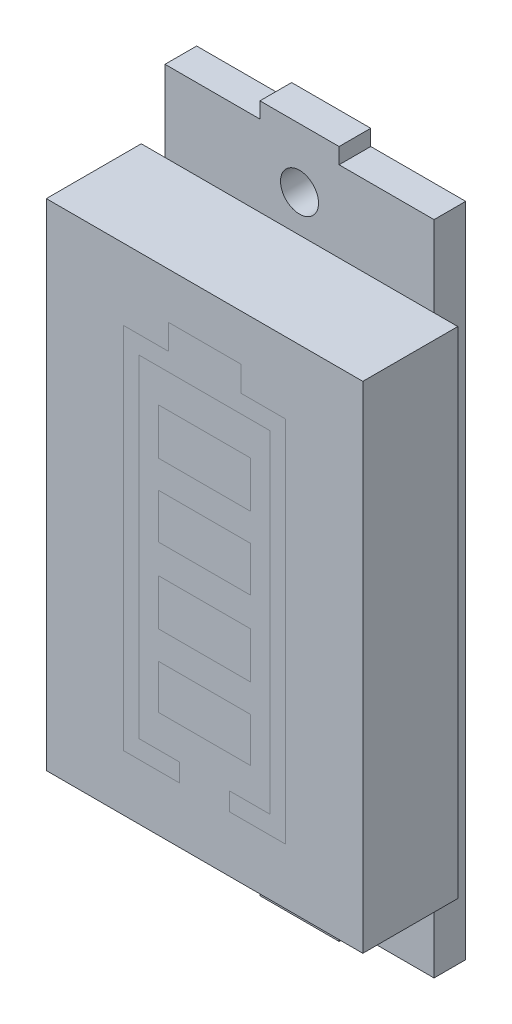
from build123d import *

# Parameters (mm, degrees)
SKETCH1_W            = 20
SKETCH1_H            = 31.3
BOSS_EXTRUDE1_DEPTH  = 6
SKETCH2_W            = 17
SKETCH2_H            = 41.5
BOSS_EXTRUDE2_DEPTH  = 2
SKETCH3_W            = 5
SKETCH3_H            = 43.5
BOSS_EXTRUDE3_DEPTH  = 2
M2_CLEARANCE_HOLE1_D = 2.4


with BuildPart() as part:
    # Sketch1 → Boss-Extrude1 (new body)
    with BuildSketch(Plane.XY):
        Rectangle(SKETCH1_W, SKETCH1_H)
    extrude(amount=BOSS_EXTRUDE1_DEPTH)

    # Sketch2 → Boss-Extrude2 (add)
    with BuildSketch(Plane(origin=(0, 0, 0), x_dir=(-1, 0, 0), z_dir=(0, 0, -1))):
        Rectangle(SKETCH2_W, SKETCH2_H)
    extrude(amount=BOSS_EXTRUDE2_DEPTH)

    # Sketch3 → Boss-Extrude3 (add)
    with BuildSketch(Plane(origin=(0, 0, -2), x_dir=(-1, 0, 0), z_dir=(0, 0, -1))):
        Rectangle(SKETCH3_W, SKETCH3_H)
    extrude(amount=-BOSS_EXTRUDE3_DEPTH)

    # M2 Clearance Hole1 (through all)
    with Locations(Plane(origin=(0, 0, -2), x_dir=(-1, 0, 0), z_dir=(0, 0, -1))):
        with Locations((0, 18), (0, -18)):
            Hole(M2_CLEARANCE_HOLE1_D / 2)


solid = part.part
